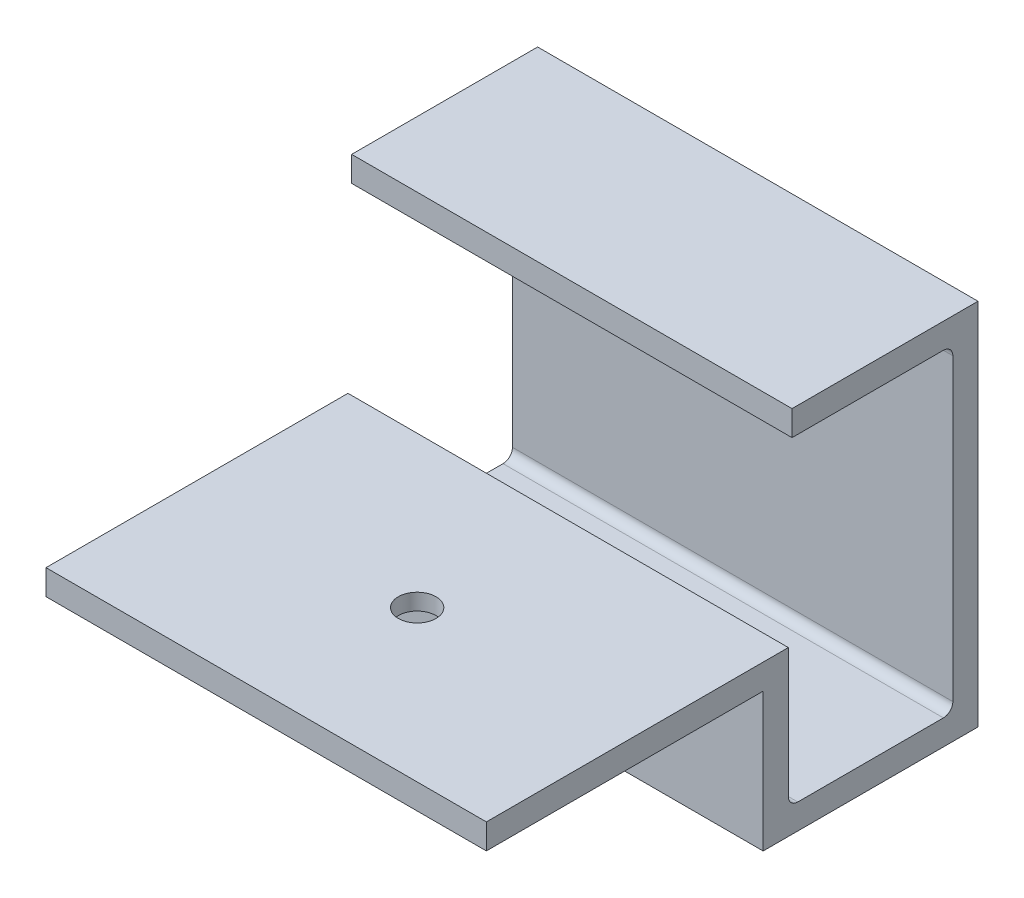
from build123d import *

# Parameters (mm, degrees)
SKETCH2_W           = 44
SKETCH2_H           = 4
SKETCH2_W_2         = 4
SKETCH2_W_3         = 26.15
SKETCH2_W_4         = 25.56
BOSS_EXTRUDE1_DEPTH = 70
FILLET1_R           = 1.5
SKETCH3_R           = 3
CUT_EXTRUDE1_DEPTH  = 95.313214875
SKETCH4_R           = 5
CUT_EXTRUDE2_DEPTH  = 1.4


with BuildPart() as part:
    # Sketch2 → Boss-Extrude1 (new body)
    with BuildSketch(Plane(origin=(0, 0, 0), x_dir=(0, 0, -1), z_dir=(1, 0, 0))):
        with Locations((-2, 0)):
            Rectangle(SKETCH2_W, SKETCH2_H)
        with Locations((22, 0)):
            Rectangle(SKETCH2_W_2, SKETCH2_H)
        Polygon((24, -2), (20, -2), (20, -24.01), (24, -24.01), (24, -20.01), align=None)
        with Locations((37.075, -22.01)):
            Rectangle(SKETCH2_W_3, SKETCH2_H)
        Polygon((50.15, 30.6), (50.15, -20.01), (50.15, -24.01), (54.15, -24.01), (54.15, 34.6), (50.15, 34.6), align=None)
        with Locations((37.37, 32.6)):
            Rectangle(SKETCH2_W_4, SKETCH2_H)
    extrude(amount=BOSS_EXTRUDE1_DEPTH)

    # Fillet1
    fillet1_edges = [part.edges().sort_by_distance(p)[0] for p in [
        (35, -20.01, -24),
        (35, -20.01, -50.15),
        (35, 30.6, -50.15),
    ]]
    fillet(fillet1_edges, radius=FILLET1_R)

    # Sketch3 → Cut-Extrude1 (cut, through all)
    with BuildSketch(Plane(origin=(0, 2, 0), x_dir=(1, 0, 0), z_dir=(0, 1, 0))):
        with Locations(Location((35, 0, 0), (0, 0, 270))):
            Circle(SKETCH3_R)
    extrude(amount=-CUT_EXTRUDE1_DEPTH, mode=Mode.SUBTRACT)

    # Sketch4 → Cut-Extrude2 (cut)
    with BuildSketch(Plane(origin=(0, -2, 0), x_dir=(1, 0, 0), z_dir=(0, 1, 0))):
        with Locations(Location((35, 0, 0), (0, 0, 270))):
            Circle(SKETCH4_R)
    extrude(amount=CUT_EXTRUDE2_DEPTH, mode=Mode.SUBTRACT)


solid = part.part
